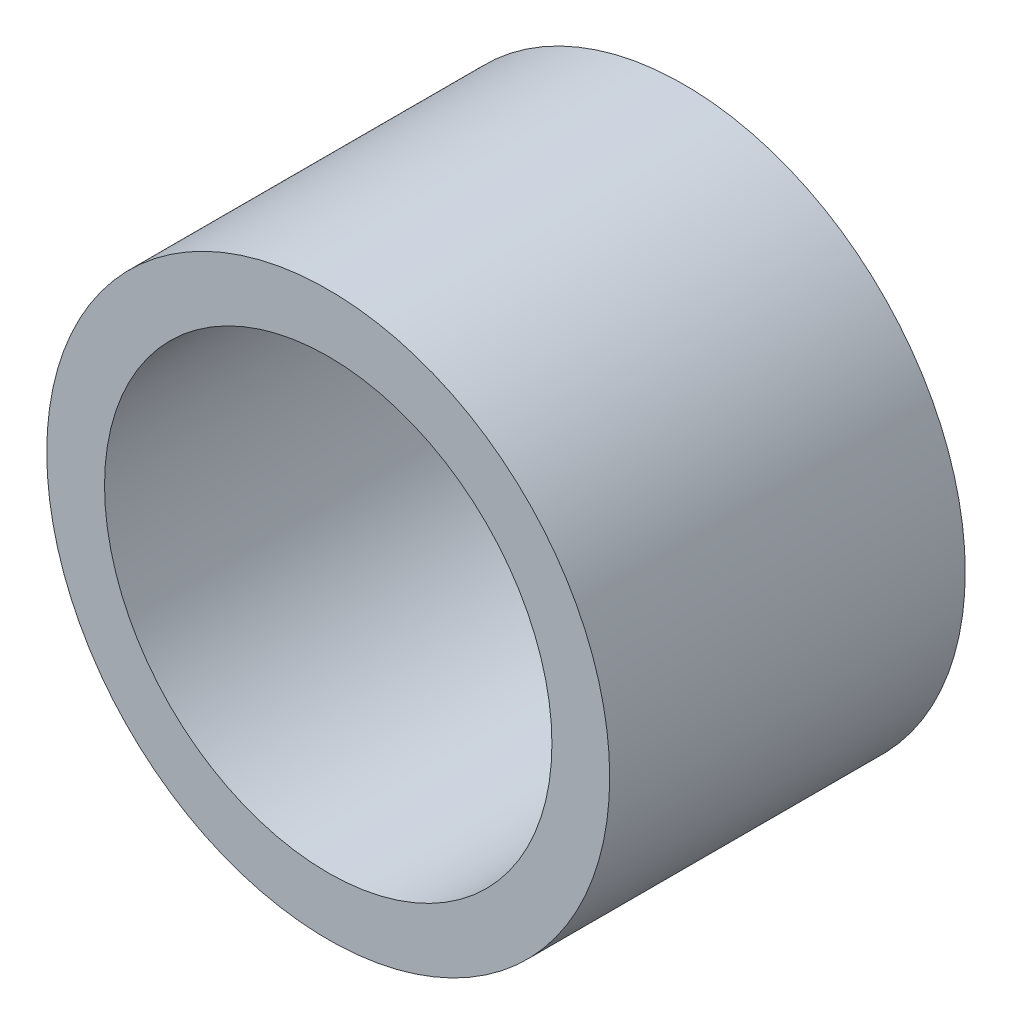
from build123d import *

# Parameters (mm, degrees)
SKETCH1_R           = 19
SKETCH1_R_2         = 15.1
BOSS_EXTRUDE1_DEPTH = 12


with BuildPart() as part:
    # Sketch1 → Boss-Extrude1 (new, symmetric)
    with BuildSketch(Plane.XY):
        Circle(SKETCH1_R)
        Circle(SKETCH1_R_2, mode=Mode.SUBTRACT)
    extrude(amount=BOSS_EXTRUDE1_DEPTH, both=True)


solid = part.part
